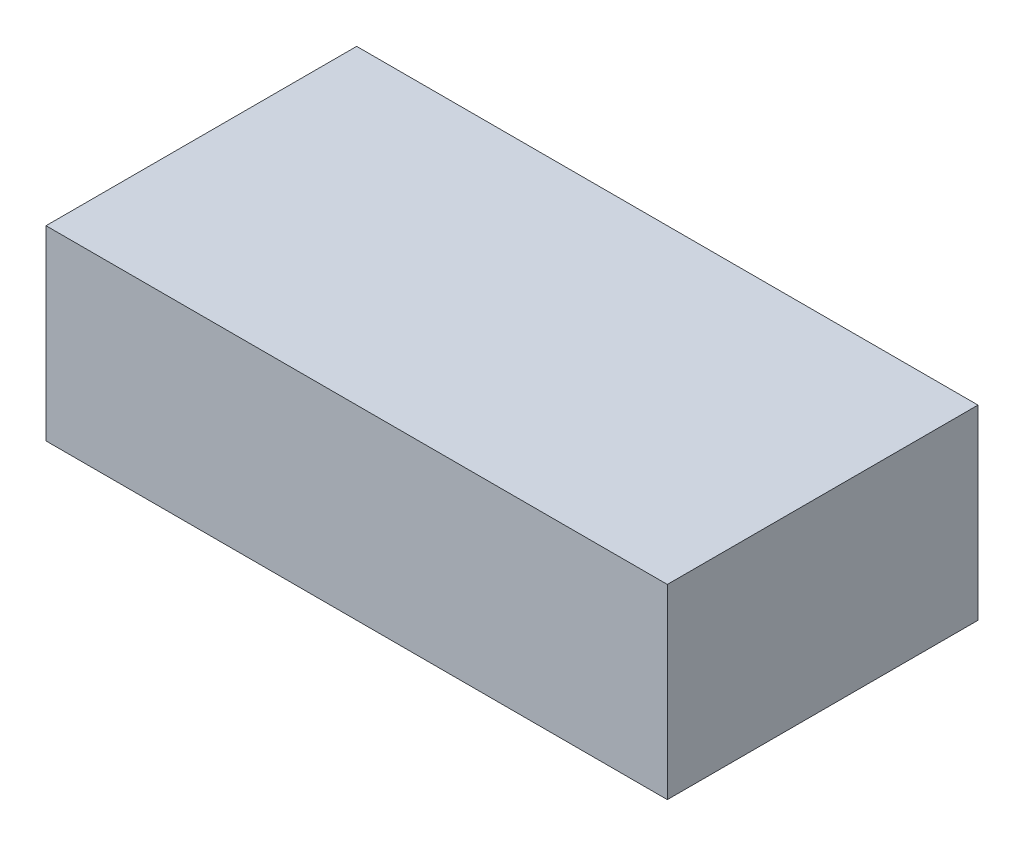
from build123d import *

# Parameters (mm, degrees)
SKETCH_1_W      = 200
SKETCH_1_H      = 100
EXTRUDE_1_DEPTH = 60


with BuildPart() as part:
    # 草图1 → 凸台-拉伸1 (new body)
    with BuildSketch(Plane(origin=(0, 0, 0), x_dir=(1, 0, 0), z_dir=(0, 1, 0))):
        Rectangle(SKETCH_1_W, SKETCH_1_H)
    extrude(amount=EXTRUDE_1_DEPTH)


solid = part.part
